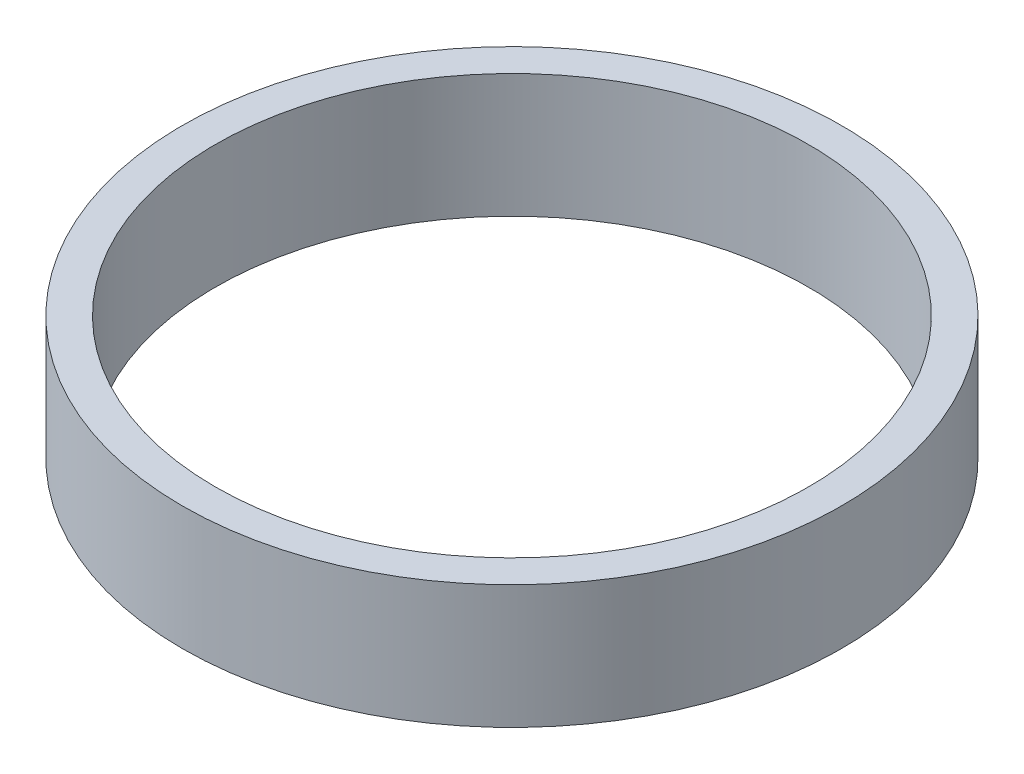
from build123d import *

# Parameters (mm, degrees)
SKETCH1_R           = 40
SKETCH1_R_2         = 36
BOSS_EXTRUDE1_DEPTH = 15


with BuildPart() as part:
    # Sketch1 → Boss-Extrude1 (new body)
    with BuildSketch(Plane(origin=(0, 0, 0), x_dir=(1, 0, 0), z_dir=(0, 1, 0))):
        with Locations(Location((0, 0, 0), (0, 0, 270))):
            Circle(SKETCH1_R)
        with Locations(Location((0, 0, 0), (0, 0, 270))):
            Circle(SKETCH1_R_2, mode=Mode.SUBTRACT)
    extrude(amount=BOSS_EXTRUDE1_DEPTH)


solid = part.part
